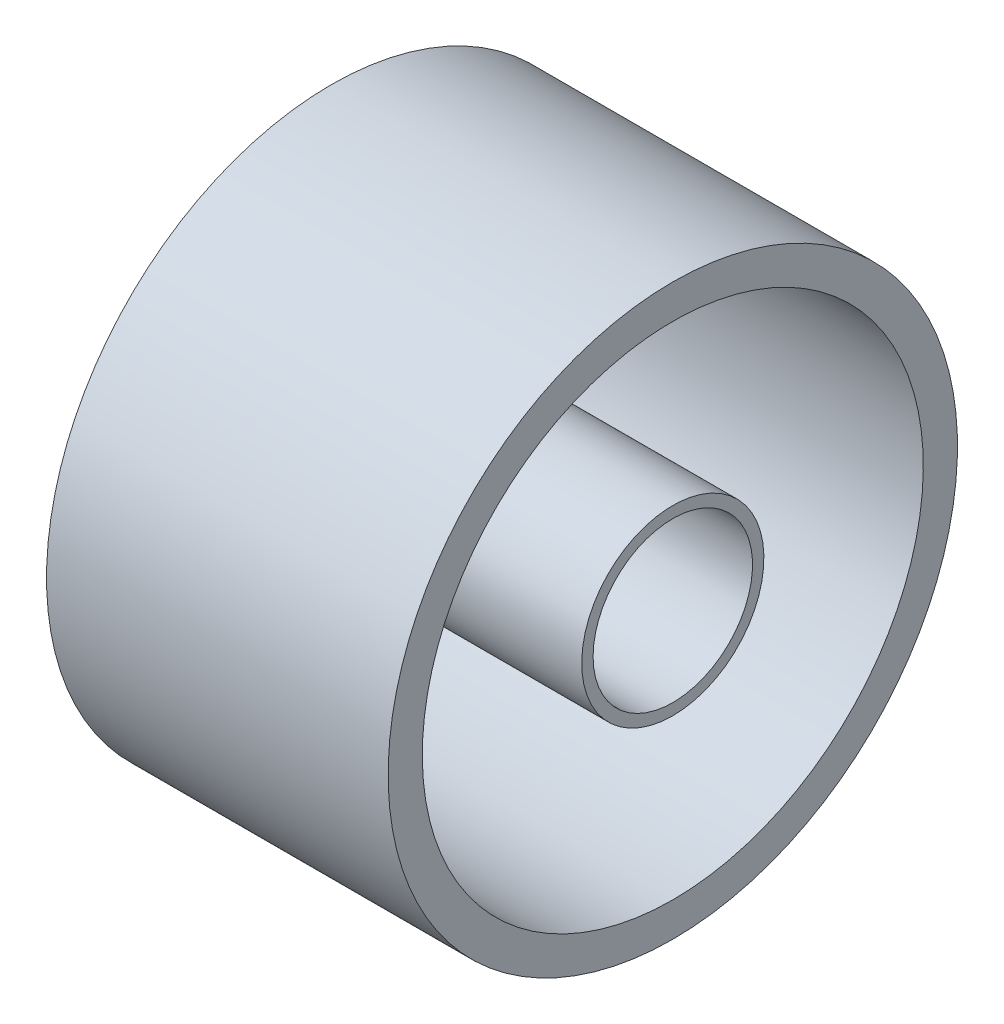
from build123d import *

# Parameters (mm, degrees)
ESBO_O1_W                = 30
ESBO_O1_H                = 25
ESBO_O2_R                = 7
CORTE_EXTRUS_O1_DEPTH    = 47.368092477
ESBO_O5_R                = 22
ESBO_O5_R_2              = 8
CORTE_EXTRUS_O3_DEPTH    = 47.368092477
ESBO_O6_W                = 15
ESBO_O6_H                = 2
RESSALTO_EXTRUS_O2_DEPTH = 2


with BuildPart() as part:
    # Esboço1 → Revolução1 (revolve)
    with BuildSketch(Plane.XY, mode=Mode.PRIVATE) as revolu_o1_sk:
        with Locations((15, -12.5)):
            Rectangle(ESBO_O1_W, ESBO_O1_H)
    revolve(revolu_o1_sk.sketch.rotate(Axis((30, 0, 0), (-1, 0, 0)), 180), axis=Axis((30, 0, 0), (-1, 0, 0)))

    # Esboço2 → Corte-extrusão1 (cut, through all)
    with BuildSketch(Plane.ZY):
        Circle(ESBO_O2_R)
    extrude(amount=-CORTE_EXTRUS_O1_DEPTH, mode=Mode.SUBTRACT)

    # Esboço5 → Corte-extrusão3 (cut, through all)
    with BuildSketch(Plane.ZY):
        with Locations(Location((0, 0, 0), (0, 0, 270))):
            Circle(ESBO_O5_R)
        with Locations(Location((0, 0, 0), (0, 0, 270))):
            Circle(ESBO_O5_R_2, mode=Mode.SUBTRACT)
    extrude(amount=-CORTE_EXTRUS_O3_DEPTH, mode=Mode.SUBTRACT)


with BuildPart() as corte_extrus_o3_piece_1:
    # of the separate pieces the step leaves, piece 1, a body of its own (corte_extrus_o3_pieces)
    add(part.part.solids().sort_by_distance((0, 25, 0))[0])



with BuildPart() as corte_extrus_o3_piece_2:
    # of the separate pieces the step leaves, piece 2, a body of its own (corte_extrus_o3_pieces)
    add(part.part.solids().sort_by_distance((0, -8, 0))[0])


with BuildPart() as corte_extrus_o3_piece_1_1:
    add(corte_extrus_o3_piece_1.part)

    add(corte_extrus_o3_piece_2.part)  # Ressalto-extrusão2 merges Corte-extrusão3 piece 2
    # Esboço6 → Ressalto-extrusão2 (add)
    with BuildSketch(Plane.ZY):
        with Locations((-14.5, 1)):
            Rectangle(ESBO_O6_W, ESBO_O6_H)
        with Locations((14.5, 1)):
            Rectangle(ESBO_O6_W, ESBO_O6_H)
    extrude(amount=-RESSALTO_EXTRUS_O2_DEPTH)


solid = corte_extrus_o3_piece_1_1.part
